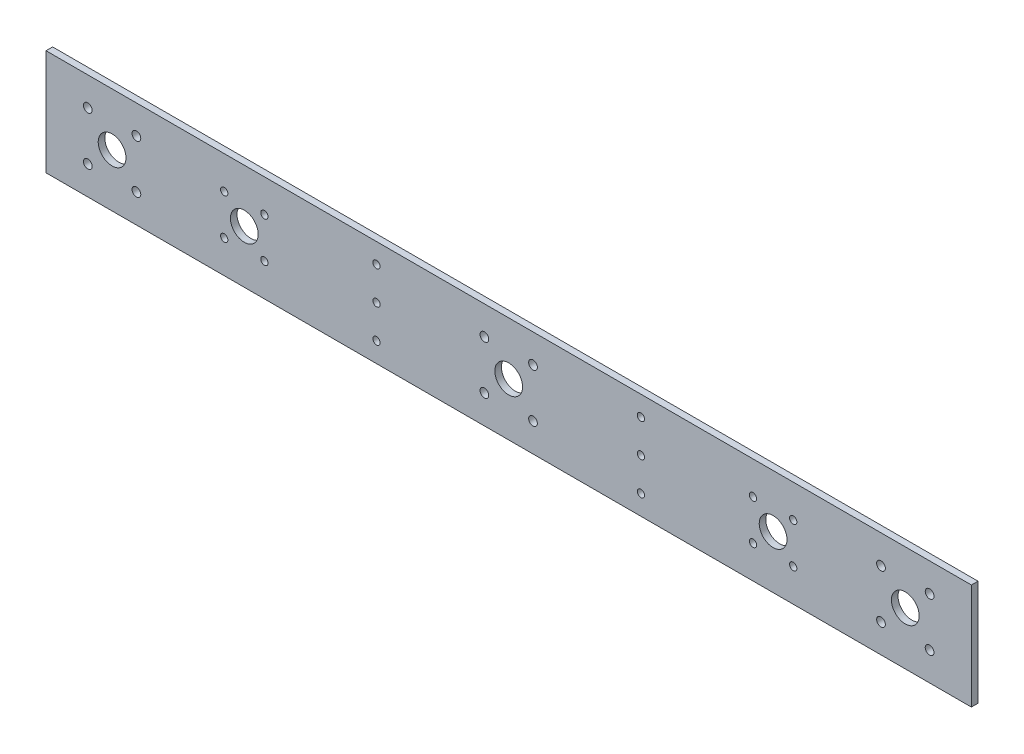
from build123d import *

# Parameters (mm, degrees)
SKETCH_1_W          = 800
SKETCH_1_H          = 80
SKETCH_1_R          = 3.3
SKETCH_1_R_2        = 2.75
SKETCH_1_R_3        = 10.5
EXTRUDE_1_DEPTH     = 5
SKETCH_2_W          = 50
SKETCH_2_H          = 80
CUT_EXTRUDE_1_DEPTH = 403.026118555


with BuildPart() as part:
    # 草图1 → 凸台-拉伸1 (new body)
    with BuildSketch(Plane.XY):
        Rectangle(SKETCH_1_W, SKETCH_1_H)
        with Locations((-318.384776311, 18.384776311)):
            Circle(SKETCH_1_R, mode=Mode.SUBTRACT)
        with Locations((-281.615223689, 18.384776311)):
            Circle(SKETCH_1_R, mode=Mode.SUBTRACT)
        with Locations((-281.615223689, -18.384776311)):
            Circle(SKETCH_1_R, mode=Mode.SUBTRACT)
        with Locations((-318.384776311, -18.384776311)):
            Circle(SKETCH_1_R, mode=Mode.SUBTRACT)
        with Locations((-215.202795796, 15.202795796)):
            Circle(SKETCH_1_R_2, mode=Mode.SUBTRACT)
        with Locations((-184.797204204, 15.202795796)):
            Circle(SKETCH_1_R_2, mode=Mode.SUBTRACT)
        with Locations((-184.797204204, -15.202795796)):
            Circle(SKETCH_1_R_2, mode=Mode.SUBTRACT)
        with Locations((-215.202795796, -15.202795796)):
            Circle(SKETCH_1_R_2, mode=Mode.SUBTRACT)
        with Locations((-200, 0)):
            Circle(SKETCH_1_R_3, mode=Mode.SUBTRACT)
        with Locations((-18.384776311, 18.384776311)):
            Circle(SKETCH_1_R, mode=Mode.SUBTRACT)
        with Locations((18.384776311, 18.384776311)):
            Circle(SKETCH_1_R, mode=Mode.SUBTRACT)
        with Locations((18.384776311, -18.384776311)):
            Circle(SKETCH_1_R, mode=Mode.SUBTRACT)
        with Locations((-18.384776311, -18.384776311)):
            Circle(SKETCH_1_R, mode=Mode.SUBTRACT)
        with Locations(Location((215.202795796, -15.202795796, 0), (0, 0, 180))):
            Circle(SKETCH_1_R_2, mode=Mode.SUBTRACT)
        with Locations(Location((184.797204204, -15.202795796, 0), (0, 0, 180))):
            Circle(SKETCH_1_R_2, mode=Mode.SUBTRACT)
        with Locations(Location((184.797204204, 15.202795796, 0), (0, 0, 180))):
            Circle(SKETCH_1_R_2, mode=Mode.SUBTRACT)
        with Locations(Location((215.202795796, 15.202795796, 0), (0, 0, 180))):
            Circle(SKETCH_1_R_2, mode=Mode.SUBTRACT)
        with Locations(Location((200, 0, 0), (0, 0, 180))):
            Circle(SKETCH_1_R_3, mode=Mode.SUBTRACT)
        with Locations(Location((318.384776311, -18.384776311, 0), (0, 0, 180))):
            Circle(SKETCH_1_R, mode=Mode.SUBTRACT)
        with Locations(Location((281.615223689, -18.384776311, 0), (0, 0, 180))):
            Circle(SKETCH_1_R, mode=Mode.SUBTRACT)
        with Locations(Location((281.615223689, 18.384776311, 0), (0, 0, 180))):
            Circle(SKETCH_1_R, mode=Mode.SUBTRACT)
        with Locations(Location((318.384776311, 18.384776311, 0), (0, 0, 180))):
            Circle(SKETCH_1_R, mode=Mode.SUBTRACT)
        with Locations((-100, 25)):
            Circle(SKETCH_1_R_2, mode=Mode.SUBTRACT)
        with Locations((-100, 0)):
            Circle(SKETCH_1_R_2, mode=Mode.SUBTRACT)
        with Locations((-100, -25)):
            Circle(SKETCH_1_R_2, mode=Mode.SUBTRACT)
        with Locations(Location((100, -25, 0), (0, 0, 180))):
            Circle(SKETCH_1_R_2, mode=Mode.SUBTRACT)
        with Locations(Location((100, 0, 0), (0, 0, 180))):
            Circle(SKETCH_1_R_2, mode=Mode.SUBTRACT)
        with Locations(Location((100, 25, 0), (0, 0, 180))):
            Circle(SKETCH_1_R_2, mode=Mode.SUBTRACT)
        with Locations((-300, 0)):
            Circle(SKETCH_1_R_3, mode=Mode.SUBTRACT)
        Circle(SKETCH_1_R_3, mode=Mode.SUBTRACT)
        with Locations(Location((300, 0, 0), (0, 0, 180))):
            Circle(SKETCH_1_R_3, mode=Mode.SUBTRACT)
    extrude(amount=EXTRUDE_1_DEPTH)

    # 草图2 → 切除-拉伸1 (cut, through all)
    with BuildSketch(Plane.XY.offset(5)):
        with Locations((-375, 0)):
            Rectangle(SKETCH_2_W, SKETCH_2_H)
        with Locations((375, 0)):
            Rectangle(SKETCH_2_W, SKETCH_2_H)
    extrude(amount=-CUT_EXTRUDE_1_DEPTH, mode=Mode.SUBTRACT)


solid = part.part
